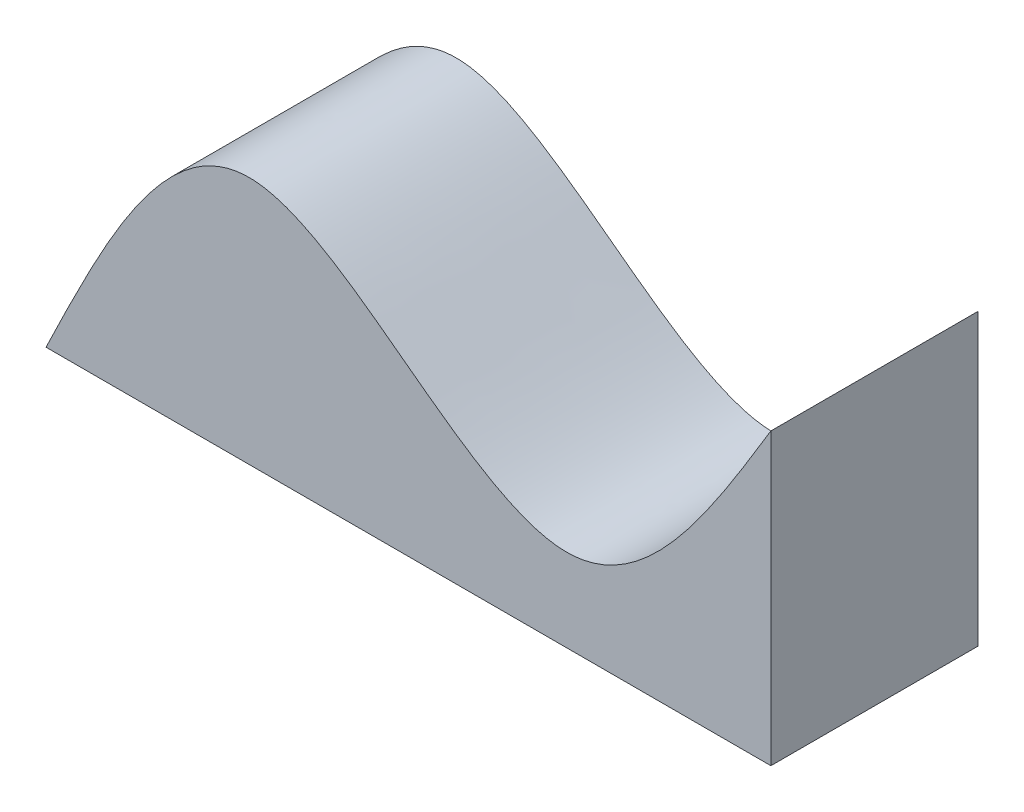
from build123d import *

# Parameters (mm, degrees)
BOSS_EXTRUDE1_DEPTH = 10


with BuildPart() as part:
    # Sketch1 → Boss-Extrude1 (new body)
    with BuildSketch(Plane.XY):
        with BuildLine():
            Line((35, 14), (35, 0))
            Line((35, 0), (0, 0))
            add(Edge.make_bspline(
                [(0, 0), (2.944119923, 6.094033719), (9.092365244, 18.820286478), (25.205855224, -2.210140525), (31.941319361, 8.937624048), (35, 14)],
                knots=[0, 0, 0, 0, 0.334038049, 0.69757616, 1, 1, 1, 1], degree=3))
        make_face()
    extrude(amount=BOSS_EXTRUDE1_DEPTH)


solid = part.part
